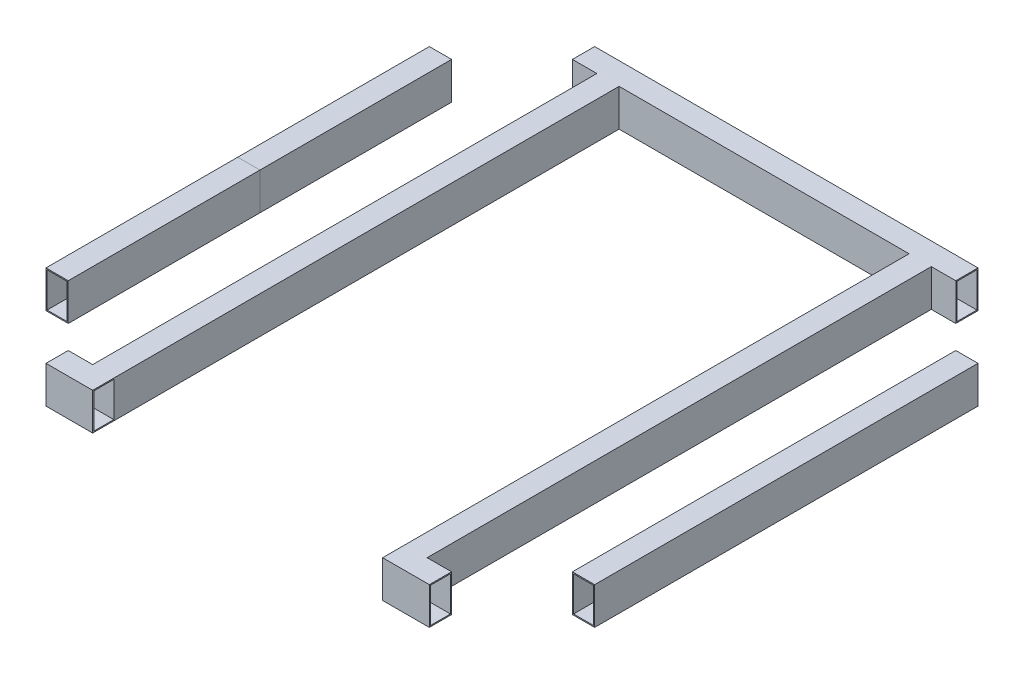
from build123d import *

# Parameters (mm, degrees)
ESBO_O2_W             = 30
ESBO_O2_H             = 50
ESBO_O2_W_2           = 27
ESBO_O2_H_2           = 47
ESBO_O3_W             = 223
ESBO_O3_H             = 223
CORTE_EXTRUS_O1_DEPTH = 185
ESBO_O6_W             = 30
ESBO_O6_H             = 50
ESBO_O8_W             = 30
ESBO_O8_H             = 50
ESBO_O13_W            = 391.08
ESBO_O13_H            = 30
CORTE_EXTRUS_O3_DEPTH = 92


with BuildPart() as part:
    # Varredura1: sweep along a path in Esboço1
    with BuildLine(Plane(origin=(0, 0, 0), x_dir=(1, 0, 0), z_dir=(0, 1, 0))) as varredura1_path:
        Line((-355, -355), (355, -355))
        Line((355, -355), (355, 355))
        Line((355, 355), (-355, 355))
        Line((-355, 355), (-355, -355))
    # Esboço2 → Varredura1 (sweep)
    with BuildSketch(Plane.XY):
        with Locations((-355, 0)):
            Rectangle(ESBO_O2_W, ESBO_O2_H)
        with Locations((-355, 0)):
            Rectangle(ESBO_O2_W_2, ESBO_O2_H_2, mode=Mode.SUBTRACT)
    sweep(path=varredura1_path.line, transition=Transition.RIGHT)

    # Esboço3 → Corte-extrusão1 (cut, symmetric)
    with BuildSketch(Plane(origin=(0, 25, 0), x_dir=(1, 0, 0), z_dir=(0, 1, 0))):
        with Locations((-370, 370)):
            Rectangle(ESBO_O3_W, ESBO_O3_H)
        with Locations((370, 370)):
            Rectangle(ESBO_O3_W, ESBO_O3_H)
        with Locations((370, -370)):
            Rectangle(ESBO_O3_W, ESBO_O3_H)
        with Locations((-370, -370)):
            Rectangle(ESBO_O3_W, ESBO_O3_H)
    extrude(amount=CORTE_EXTRUS_O1_DEPTH, both=True, mode=Mode.SUBTRACT)


with BuildPart() as corte_extrus_o1_piece_1:
    # of the separate pieces the step leaves, piece 1, a body of its own (corte_extrus_o1_pieces)
    add(part.part.solids().sort_by_distance((-370, -25, 258.5))[0])


with BuildPart() as corte_extrus_o1_piece_2:
    # of the separate pieces the step leaves, piece 2, a body of its own (corte_extrus_o1_pieces)
    add(part.part.solids().sort_by_distance((-258.5, -25, -340))[0])



with BuildPart() as corte_extrus_o1_piece_3:
    # of the separate pieces the step leaves, piece 3, a body of its own (corte_extrus_o1_pieces)
    add(part.part.solids().sort_by_distance((-258.5, -25, 370))[0])


with BuildPart() as corte_extrus_o1_piece_4:
    # of the separate pieces the step leaves, piece 4, a body of its own (corte_extrus_o1_pieces)
    add(part.part.solids().sort_by_distance((370, -25, 258.5))[0])


with BuildPart() as corte_extrus_o1_piece_2_1:
    add(corte_extrus_o1_piece_2.part)

    add(corte_extrus_o1_piece_3.part)  # Varredura2 merges Corte-extrusão1 piece 3
    # Varredura2: sweep along a path in Esboço4
    with BuildLine(Plane(origin=(0, 0, 0), x_dir=(1, 0, 0), z_dir=(0, 1, 0))) as varredura2_path:
        Line((-210.54, 340), (-210.54, -340))
    # Esboço6 → Varredura2 (sweep)
    with BuildSketch(Plane.XY):
        with Locations((-210.54, 0)):
            Rectangle(ESBO_O6_W, ESBO_O6_H)
    sweep(path=varredura2_path.line)

    # Varredura3: sweep along a path in Esboço7
    with BuildLine(Plane(origin=(0, 0, 0), x_dir=(1, 0, 0), z_dir=(0, 1, 0))) as varredura3_path:
        Line((210.54, 340), (210.54, -340))
    # Esboço8 → Varredura3 (sweep)
    with BuildSketch(Plane.XY):
        with Locations((210.54, 0)):
            Rectangle(ESBO_O8_W, ESBO_O8_H)
    sweep(path=varredura3_path.line)

    # Esboço13 → Corte-extrusão3 (cut)
    with BuildSketch(Plane(origin=(0, 25, 0), x_dir=(1, 0, 0), z_dir=(0, 1, 0))):
        with Locations((0, -355)):
            Rectangle(ESBO_O13_W, ESBO_O13_H)
    extrude(amount=-CORTE_EXTRUS_O3_DEPTH, mode=Mode.SUBTRACT)


solid = Compound([corte_extrus_o1_piece_1.part, corte_extrus_o1_piece_4.part, corte_extrus_o1_piece_2_1.part])
